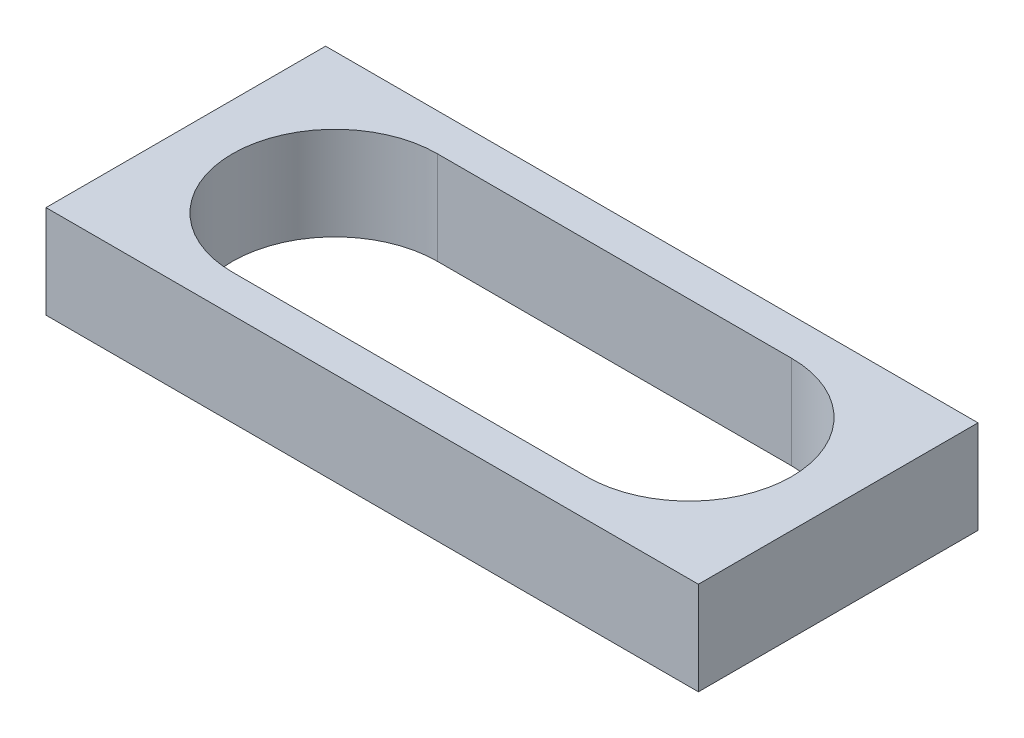
from build123d import *

# Parameters (mm, degrees)
SKETCH1_W           = 44.45
SKETCH1_H           = 19.05
BOSS_EXTRUDE1_DEPTH = 6.35


with BuildPart() as part:
    # Sketch1 → Boss-Extrude1 (new body)
    with BuildSketch(Plane(origin=(0, 0, 0), x_dir=(1, 0, 0), z_dir=(0, 1, 0))):
        Rectangle(SKETCH1_W, SKETCH1_H)
        with BuildLine():
            Line((-12.065, 6.985), (12.065, 6.985))
            ThreePointArc((12.065, 6.985), (19.05, 0), (12.065, -6.985))
            Line((12.065, -6.985), (-12.065, -6.985))
            ThreePointArc((-12.065, -6.985), (-19.05, 0), (-12.065, 6.985))
        make_face(mode=Mode.SUBTRACT)
    extrude(amount=BOSS_EXTRUDE1_DEPTH)


solid = part.part
